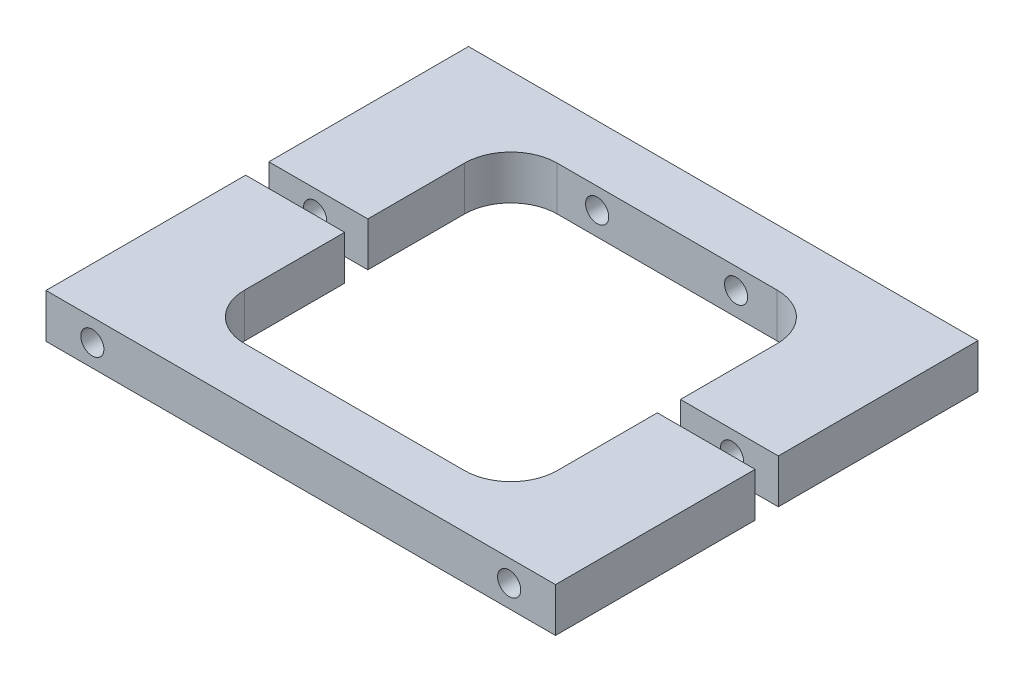
from build123d import *

# Parameters (mm, degrees)
ESBO_O1_W                = 110
ESBO_O1_H                = 90
RESSALTO_EXTRUS_O1_DEPTH = 9.52
ESBO_O6_W                = 110
ESBO_O6_H                = 1.22
RESSALTO_EXTRUS_O3_DEPTH = 9.52
CORTE_EXTRUS_O6_DEPTH    = 9.52
ESBO_O9_W                = 110
ESBO_O9_H                = 5
CORTE_EXTRUS_O7_DEPTH    = 9.52
ESBO_O10_R               = 2.5
CORTE_EXTRUS_O8_DEPTH    = 70
ESBO_O7_R                = 2.5
CORTE_EXTRUS_O9_DEPTH    = 15


with BuildPart() as part:
    # Esboço1 → Ressalto-extrusão1 (new body)
    with BuildSketch(Plane(origin=(0, 0, 0), x_dir=(1, 0, 0), z_dir=(0, 1, 0))):
        Rectangle(ESBO_O1_W, ESBO_O1_H)
    extrude(amount=RESSALTO_EXTRUS_O1_DEPTH)

    # Esboço6 → Ressalto-extrusão3 (add)
    with BuildSketch(Plane(origin=(0, 9.52, 0), x_dir=(1, 0, 0), z_dir=(0, 1, 0))):
        with Locations((0, 45.61)):
            Rectangle(ESBO_O6_W, ESBO_O6_H)
    extrude(amount=-RESSALTO_EXTRUS_O3_DEPTH)

    # Esboço2 → Corte-extrusão6 (cut)
    with BuildSketch(Plane(origin=(0, 9.52, 0), x_dir=(1, 0, 0), z_dir=(0, 1, 0))):
        with BuildLine():
            Line((-23.627508058, 33.994983885), (23.872491942, 33.994983885))
            ThreePointArc((23.872491942, 33.994983885), (30.943559754, 31.066051697), (33.872491942, 23.994983885))
            Line((33.872491942, 23.994983885), (33.872491942, -23.505016115))
            ThreePointArc((33.872491942, -23.505016115), (30.943559754, -30.576083927), (23.872491942, -33.505016115))
            Line((23.872491942, -33.505016115), (-23.627508058, -33.505016115))
            ThreePointArc((-23.627508058, -33.505016115), (-30.698575869, -30.576083927), (-33.627508058, -23.505016115))
            Line((-33.627508058, -23.505016115), (-33.627508058, 23.994983885))
            ThreePointArc((-33.627508058, 23.994983885), (-30.698575869, 31.066051697), (-23.627508058, 33.994983885))
        make_face()
    extrude(amount=-CORTE_EXTRUS_O6_DEPTH, mode=Mode.SUBTRACT)

    # Esboço9 → Corte-extrusão7 (cut)
    with BuildSketch(Plane(origin=(0, 9.52, 0), x_dir=(1, 0, 0), z_dir=(0, 1, 0))):
        with Locations((0, 0.61)):
            Rectangle(ESBO_O9_W, ESBO_O9_H)
    extrude(amount=-CORTE_EXTRUS_O7_DEPTH, mode=Mode.SUBTRACT)


with BuildPart() as corte_extrus_o7_piece_1:
    # of the separate pieces the step leaves, piece 1, a body of its own (corte_extrus_o7_pieces)
    add(part.part.solids().sort_by_distance((55, 9.52, -3.11))[0])


with BuildPart() as corte_extrus_o7_piece_2:
    # of the separate pieces the step leaves, piece 2, a body of its own (corte_extrus_o7_pieces)
    add(part.part.solids().sort_by_distance((55, 0, 45))[0])


with BuildPart() as corte_extrus_o8_tool:
    # Esboço10 → Corte-extrusão8 (new body)
    with BuildSketch(Plane.XY.offset(45)):
        with Locations((-45, 4.76)):
            Circle(ESBO_O10_R)
        with Locations(Location((45, 4.76, 0), (0, 0, 180))):
            Circle(ESBO_O10_R)
    extrude(amount=-CORTE_EXTRUS_O8_DEPTH)


with BuildPart() as corte_extrus_o7_piece_1_1:
    add(corte_extrus_o7_piece_1.part)

    # Corte-extrusão8: cut by corte_extrus_o8_tool
    add(corte_extrus_o8_tool.part, mode=Mode.SUBTRACT)

    # Esboço7 → Corte-extrusão9 (cut)
    with BuildSketch(Plane(origin=(0, 0, -46.22), x_dir=(-1, 0, 0), z_dir=(0, 0, -1))):
        with Locations((-45, 4.76)):
            Circle(ESBO_O7_R)
        with Locations(Location((45, 4.76, 0), (0, 0, 180))):
            Circle(ESBO_O7_R)
        with Locations((-15, 5)):
            Circle(ESBO_O7_R)
        with Locations((15, 5)):
            Circle(ESBO_O7_R)
    extrude(amount=-CORTE_EXTRUS_O9_DEPTH, mode=Mode.SUBTRACT)


with BuildPart() as corte_extrus_o7_piece_2_1:
    add(corte_extrus_o7_piece_2.part)

    # Corte-extrusão8: cut by corte_extrus_o8_tool
    add(corte_extrus_o8_tool.part, mode=Mode.SUBTRACT)


solid = Compound([corte_extrus_o7_piece_1_1.part, corte_extrus_o7_piece_2_1.part])
